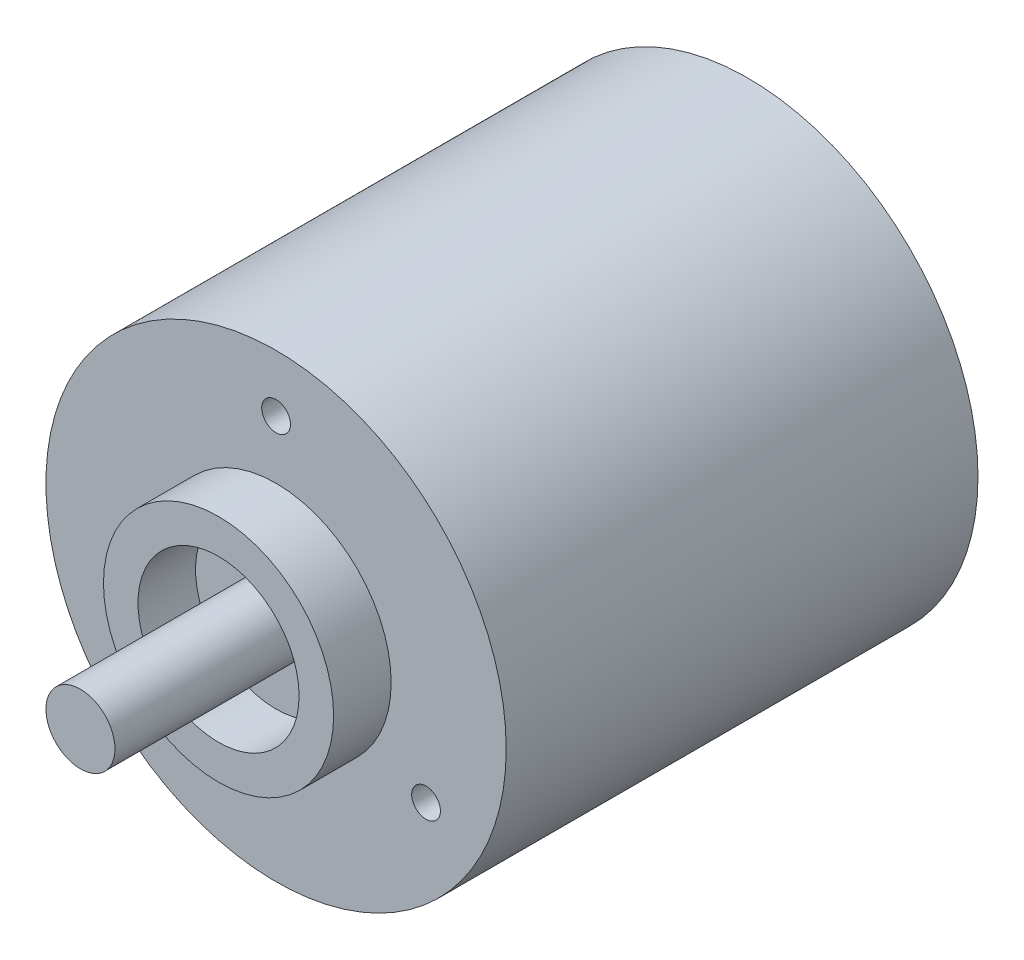
from build123d import *

# Parameters (mm, degrees)
ESQUISSE1_R             = 20
BOSS_EXTRU_1_DEPTH      = 41
ESQUISSE2_R             = 10
ESQUISSE2_R_2           = 7
BOSS_EXTRU_2_DEPTH      = 5
ESQUISSE3_R             = 3
BOSS_EXTRU_3_DEPTH      = 17
ESQUISSE4_R             = 1.25
ENL_V_MAT_EXTRU_1_DEPTH = 7.9


with BuildPart() as part:
    # Esquisse1 → Boss.-Extru.1 (new body)
    with BuildSketch(Plane.XY):
        Circle(ESQUISSE1_R)
    extrude(amount=-BOSS_EXTRU_1_DEPTH)

    # Esquisse2 → Boss.-Extru.2 (add)
    with BuildSketch(Plane.XY):
        Circle(ESQUISSE2_R)
        Circle(ESQUISSE2_R_2, mode=Mode.SUBTRACT)
    extrude(amount=BOSS_EXTRU_2_DEPTH)

    # Esquisse3 → Boss.-Extru.3 (add)
    with BuildSketch(Plane.XY):
        Circle(ESQUISSE3_R)
    extrude(amount=BOSS_EXTRU_3_DEPTH)

    # Esquisse4 → Enlèv. mat.-Extru.1 (cut)
    with BuildSketch(Plane.XY):
        with Locations((0, 15.05)):
            Circle(ESQUISSE4_R)
        with Locations((13.033682327, -7.525)):
            Circle(ESQUISSE4_R)
        with Locations((-13.033682327, -7.525)):
            Circle(ESQUISSE4_R)
    extrude(amount=-ENL_V_MAT_EXTRU_1_DEPTH, mode=Mode.SUBTRACT)


solid = part.part
